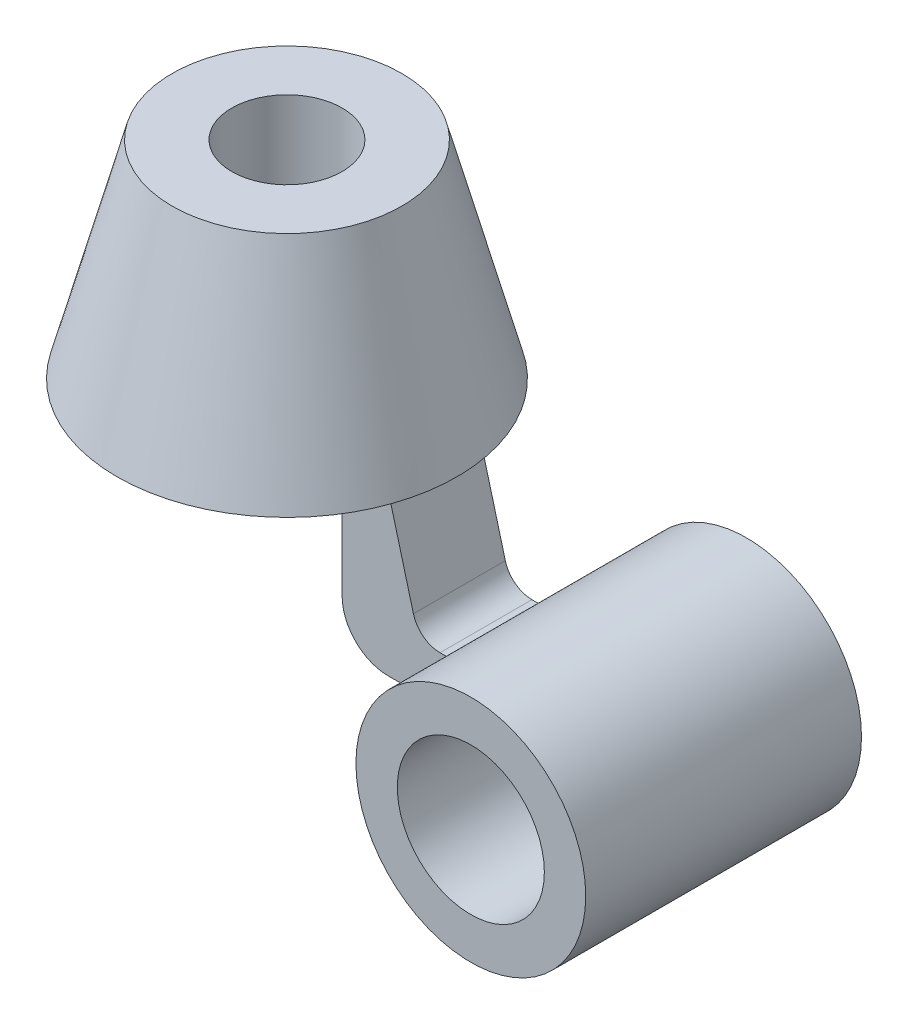
from build123d import *

# Parameters (mm, degrees)
SKETCH2_R             = 25
BOSS_EXTRUDE1_DEPTH   = 30
BOSS_EXTRUDE2_DEPTH   = 10
FILLET1_R             = 10
FILLET2_R             = 6
F_1_0MM_DOWEL_HOLE1_D = 24
F_1_0MM_DOWEL_HOLE2_D = 32


with BuildPart() as part:
    # Sketch1 → Revolve1 (revolve)
    with BuildSketch(Plane.XY, mode=Mode.PRIVATE) as revolve1_sk:
        Polygon((0, 0), (37, 0), (25, 45), (0, 45), align=None)
    revolve(revolve1_sk.sketch.rotate(Axis((0, 45, 0), (0, -1, 0)), 90), axis=Axis((0, 45, 0), (0, -1, 0)))



with BuildPart() as body_2:
    # Sketch2 → Boss-Extrude1 (new, symmetric)
    with BuildSketch(Plane.XY):
        with Locations((70, -35)):
            Circle(SKETCH2_R)
    extrude(amount=BOSS_EXTRUDE1_DEPTH, both=True)


with BuildPart() as part_1:
    add(part.part)

    add(body_2.part)  # Boss-Extrude2 merges body 2
    # Sketch3 → Boss-Extrude2 (add, symmetric)
    with BuildSketch(Plane.XY):
        Polygon((22, 0), (22, -35), (54.188700462, -35), (54.188700462, -25), (38.698729811, -25), (32, 0), align=None)
    extrude(amount=BOSS_EXTRUDE2_DEPTH, both=True)

    # Fillet1
    fillet1_edges = [part_1.edges().sort_by_distance(p)[0] for p in [
        (22, -35, 0),
    ]]
    fillet(fillet1_edges, radius=FILLET1_R)

    # Fillet2
    fillet2_edges = [part_1.edges().sort_by_distance(p)[0] for p in [
        (38.698729811, -25, 0),
    ]]
    fillet(fillet2_edges, radius=FILLET2_R)

    # Ø1.0mm Dowel Hole1 (through all)
    with Locations(Plane(origin=(0, 45, 0), x_dir=(1, 0, 0), z_dir=(0, 1, 0))):
        with Locations((0, 0)):
            Hole(F_1_0MM_DOWEL_HOLE1_D / 2)

    # Ø1.0mm Dowel Hole2 (through all)
    with Locations(Plane.XY.offset(30)):
        with Locations((70, -35)):
            Hole(F_1_0MM_DOWEL_HOLE2_D / 2)


solid = part_1.part
